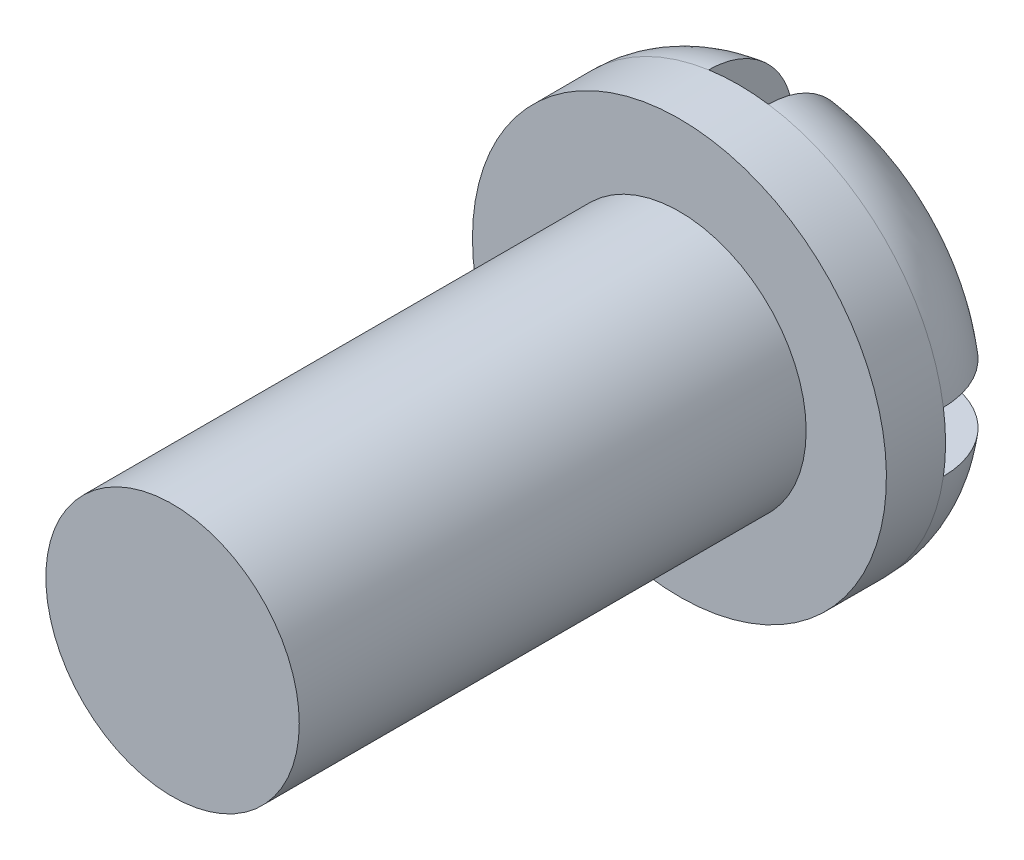
from build123d import *

# Parameters (mm, degrees)
SKETCH_1_R          = 3
EXTRUDE_1_DEPTH     = 12
SKETCH_2_R          = 4.9
EXTRUDE_2_DEPTH     = 3.4
FILLET_1_R          = 2
CUT_EXTRUDE_1_DEPTH = 2


with BuildPart() as part:
    # 草图1 → 凸台-拉伸1 (new body)
    with BuildSketch(Plane.XY):
        Circle(SKETCH_1_R)
    extrude(amount=EXTRUDE_1_DEPTH)

    # 草图2 → 凸台-拉伸2 (add)
    with BuildSketch(Plane(origin=(0, 0, 0), x_dir=(-1, 0, 0), z_dir=(0, 0, -1))):
        Circle(SKETCH_2_R)
    extrude(amount=EXTRUDE_2_DEPTH)

    # 圆角1
    fillet_1_edges = [part.edges().sort_by_distance(p)[0] for p in [
        (4.9, 0, -3.4),
    ]]
    fillet(fillet_1_edges, radius=FILLET_1_R)

    # 草图3 → 切除-拉伸1 (cut)
    with BuildSketch(Plane(origin=(0, 0, -3.4), x_dir=(-1, 0, 0), z_dir=(0, 0, -1))):
        Polygon((-0.707106781, 0.707106781), (-0.707106781, 6.006401657), (0.707106781, 6.006401657), (0.707106781, 0.707106781), (6.006401657, 0.707106781), (6.006401657, -0.707106781), (0.707106781, -0.707106781), (0.707106781, -6.006401657), (-0.707106781, -6.006401657), (-0.707106781, -0.707106781), (-6.006401657, -0.707106781), (-6.006401657, 0.707106781), align=None)
    extrude(amount=-CUT_EXTRUDE_1_DEPTH, mode=Mode.SUBTRACT)


solid = part.part
